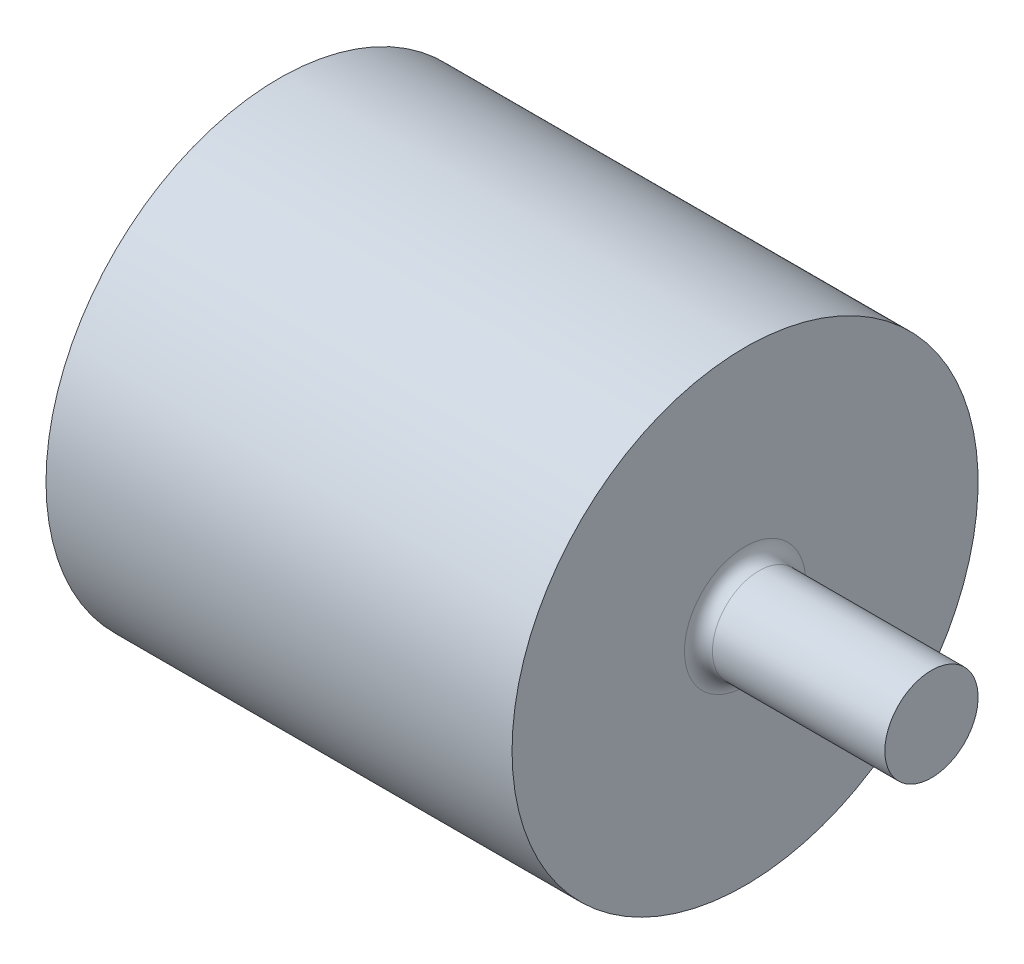
from build123d import *

# Parameters (mm, degrees)
VERRUNDUNG1_R = 0.3


with BuildPart() as part:
    # Skizze1 → Rotation1 (revolve)
    with BuildSketch(Plane.XY, mode=Mode.PRIVATE) as rotation1_sk:
        Polygon((-4.9934616, 5), (5.0065384, 5), (5.0065384, 1), (9.0065384, 1), (9.0065384, 0), (4.980418956, 0), (-4.9934616, 0), align=None)
    revolve(rotation1_sk.sketch.rotate(Axis((-0.006521322, 0, 0), (1, 0, 0)), 90), axis=Axis((-0.006521322, 0, 0), (1, 0, 0)))

    # Verrundung1
    verrundung1_edges = [part.edges().sort_by_distance(p)[0] for p in [
        (5.0065384, 0, -1),
    ]]
    fillet(verrundung1_edges, radius=VERRUNDUNG1_R)


solid = part.part
